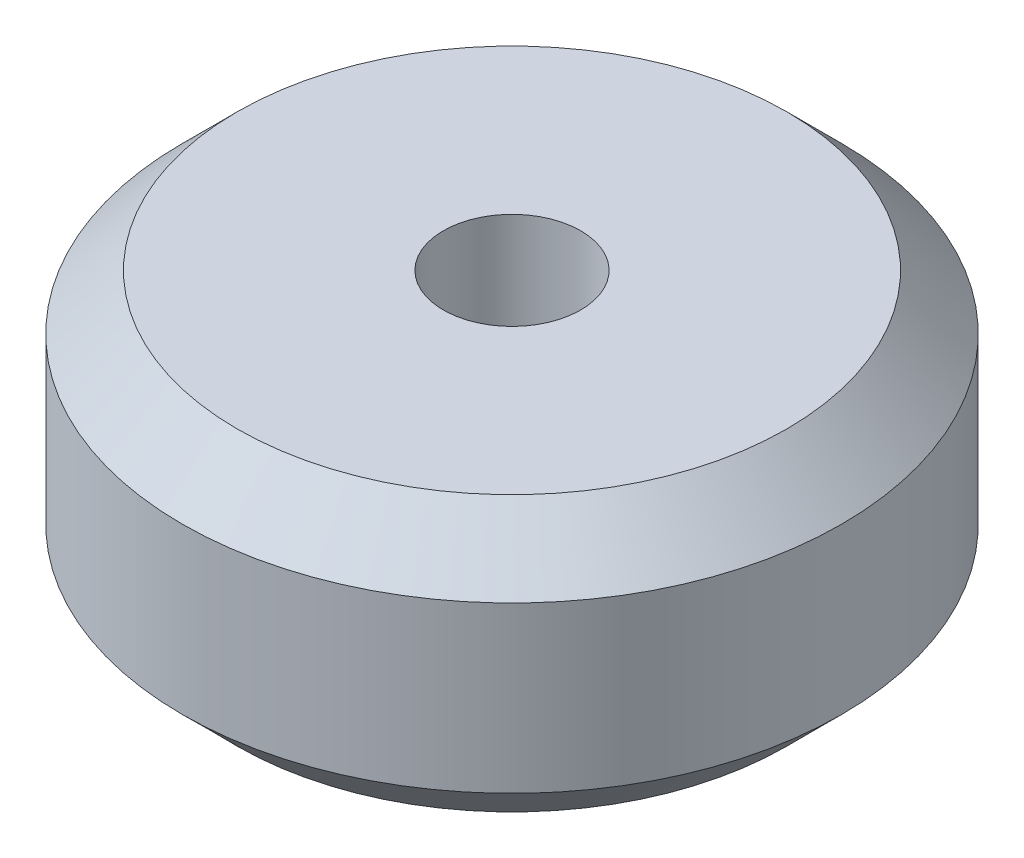
from build123d import *


with BuildPart() as part:
    # Sketch1 → Revolve1 (revolve)
    with BuildSketch(Plane(origin=(0, 0, 0), x_dir=(0, 0, -1), z_dir=(1, 0, 0))):
        Polygon((2.5, 10), (2.5, 0), (10, 0), (12, 2), (12, 8), (10, 10), align=None)
    revolve(axis=Axis((0, 0, 0), (0, 1, 0)))


solid = part.part
